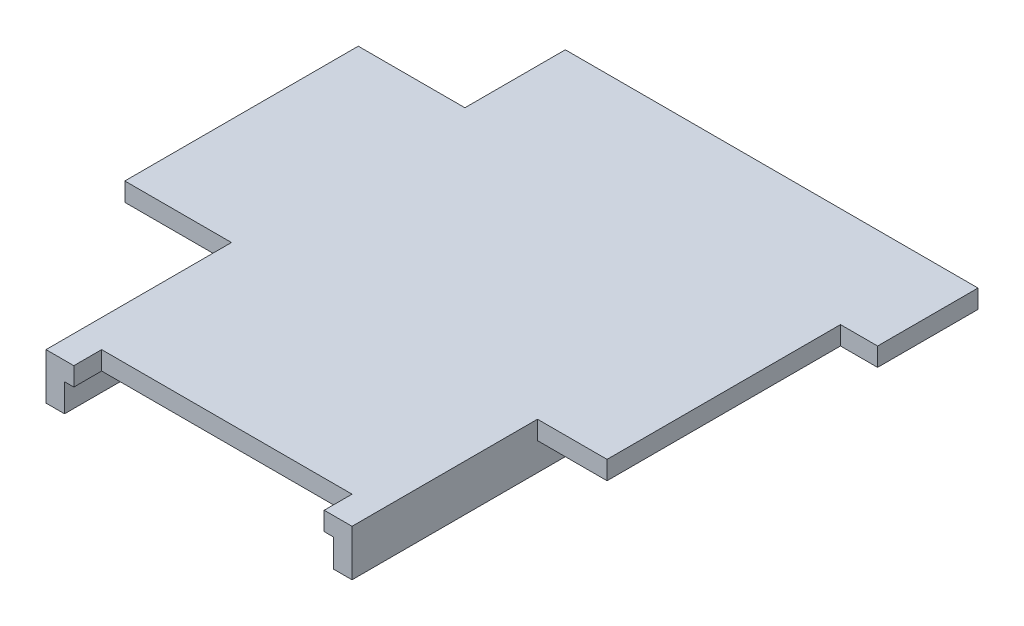
from build123d import *

# Parameters (mm, degrees)
SALIENTE_EXTRUIR1_DEPTH = 2
CROQUIS4_W              = 53.035898385
CROQUIS4_H              = 5
SALIENTE_EXTRUIR2_DEPTH = 2
CROQUIS5_W              = 53.035898385
CROQUIS5_H              = 5
SALIENTE_EXTRUIR3_DEPTH = 2
CROQUIS6_W              = 11.5
CROQUIS6_H              = 10.828307393
CROQUIS6_W_2            = 27
CROQUIS6_H_2            = 3
CORTAR_EXTRUIR1_DEPTH   = 10


with BuildPart() as part:
    # Croquis3 → Saliente-Extruir1 (new body)
    with BuildSketch(Plane(origin=(0, 0, 0), x_dir=(1, 0, 0), z_dir=(0, 1, 0))):
        Polygon((10.064101615, 59.412461498), (60.135898385, 59.412461498), (63.1, 59.412461498), (63.1, 56.448359883), (63.1, 48.584154105), (59.1, 48.584154105), (59.1, 23.412461498), (49.6, 23.412461498), (49.6, 3.412461498), (20.6, 3.412461498), (20.6, 23.412461498), (7.1, 23.412461498), (7.1, 56.448359883), (7.1, 59.412461498), align=None)
    extrude(amount=SALIENTE_EXTRUIR1_DEPTH)

    # Croquis4 → Saliente-Extruir2 (add)
    with BuildSketch(Plane.ZY.offset(-20.6)):
        with Locations((-29.930410691, -0.5)):
            Rectangle(CROQUIS4_W, CROQUIS4_H)
    extrude(amount=SALIENTE_EXTRUIR2_DEPTH)

    # Croquis5 → Saliente-Extruir3 (add)
    with BuildSketch(Plane(origin=(49.6, 0, 0), x_dir=(0, 0, -1), z_dir=(1, 0, 0))):
        with Locations((29.930410691, -0.5)):
            Rectangle(CROQUIS5_W, CROQUIS5_H)
    extrude(amount=SALIENTE_EXTRUIR3_DEPTH)

    # Croquis6 → Cortar-Extruir1 (cut)
    with BuildSketch(Plane(origin=(0, 2, 0), x_dir=(1, 0, 0), z_dir=(0, 1, 0))):
        with Locations((12.85, 53.998307802)):
            Rectangle(CROQUIS6_W, CROQUIS6_H)
        with Locations((35.1, 4.912461498)):
            Rectangle(CROQUIS6_W_2, CROQUIS6_H_2)
    extrude(amount=-CORTAR_EXTRUIR1_DEPTH, mode=Mode.SUBTRACT)


solid = part.part
